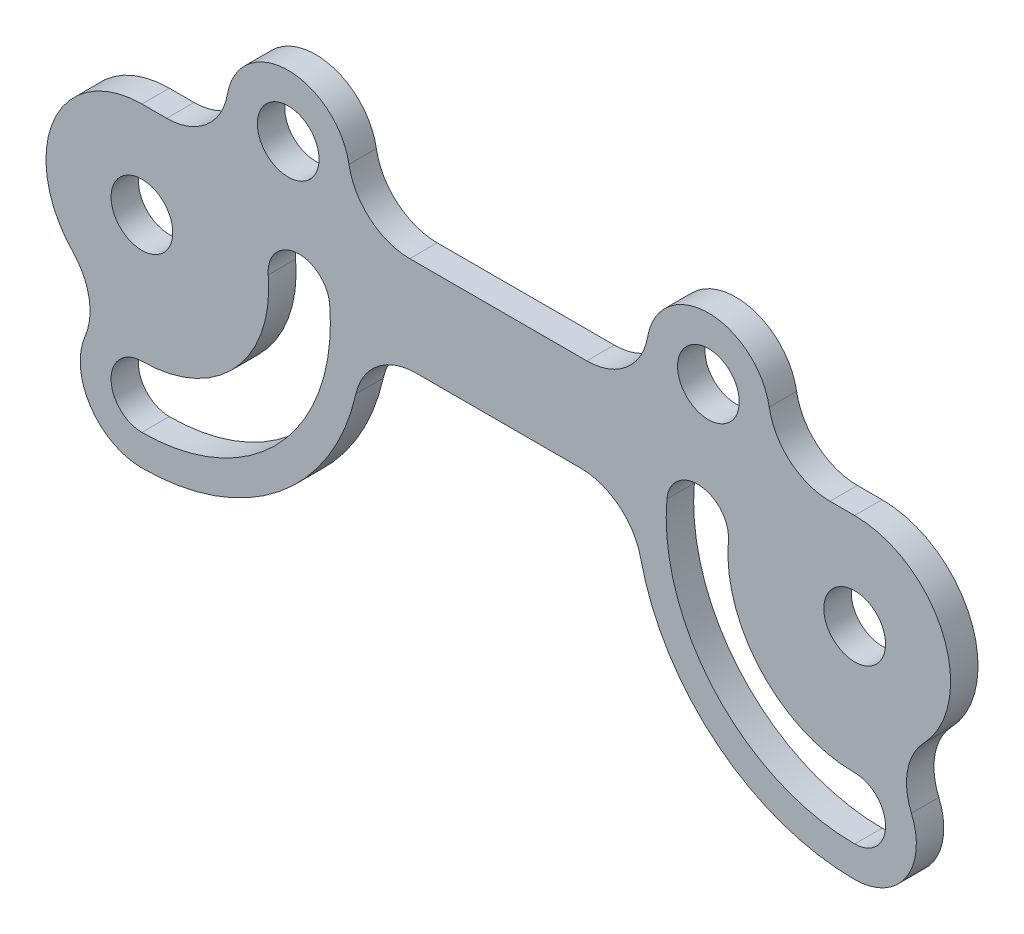
from build123d import *

# Parameters (mm, degrees)
SKETCH1_R           = 1.7859375
BOSS_EXTRUDE1_DEPTH = 1.5875
FILLET1_R           = 3.571875


with BuildPart() as part:
    # Sketch1 → Boss-Extrude1 (new body)
    with BuildSketch(Plane.XY):
        with BuildLine():
            ThreePointArc((41.275, -12.7), (44.846875, -9.128125), (41.275, -5.55625))
            ThreePointArc((41.275, -5.55625), (46.83125, 0), (41.275, 5.55625))
            Line((41.275, 5.55625), (35.489019559, 5.55625))
            ThreePointArc((35.489019559, 5.55625), (32.804229109, 11.484009389), (30.119438658, 5.55625))
            Line((30.119438658, 5.55625), (11.155561342, 5.55625))
            ThreePointArc((11.155561342, 5.55625), (8.470770891, 11.484009389), (5.785980441, 5.55625))
            Line((5.785980441, 5.55625), (0, 5.55625))
            ThreePointArc((0, 5.55625), (-5.55625, 0), (0, -5.55625))
            ThreePointArc((0, -5.55625), (-3.571875, -9.128125), (0, -12.7))
            ThreePointArc((0, -12.7), (8.980256121, -8.980256121), (12.7, 0))
            Line((12.7, 0), (28.575, 0))
            ThreePointArc((28.575, 0), (32.294743879, -8.980256121), (41.275, -12.7))
        make_face()
        with BuildLine():
            ThreePointArc((0, -10.9140625), (-1.7859375, -9.128125), (0, -7.3421875))
            ThreePointArc((0, -7.3421875), (5.413228446, -4.960309977), (7.31424826, 0.639913805))
            ThreePointArc((7.31424826, 0.639913805), (8.937735019, 2.574709983), (10.872531197, 0.951223224))
            ThreePointArc((10.872531197, 0.951223224), (8.046690934, -7.37343375), (0, -10.9140625))
        make_face(mode=Mode.SUBTRACT)
        with BuildLine():
            ThreePointArc((33.96075174, 0.639913805), (35.861771554, -4.960309977), (41.275, -7.3421875))
            ThreePointArc((41.275, -7.3421875), (43.0609375, -9.128125), (41.275, -10.9140625))
            ThreePointArc((41.275, -10.9140625), (33.228309066, -7.37343375), (30.402468803, 0.951223224))
            ThreePointArc((30.402468803, 0.951223224), (32.337264981, 2.574709983), (33.96075174, 0.639913805))
        make_face(mode=Mode.SUBTRACT)
        Circle(SKETCH1_R, mode=Mode.SUBTRACT)
        with Locations((8.470770891, 7.912134389)):
            Circle(SKETCH1_R, mode=Mode.SUBTRACT)
        with Locations((41.275, 0)):
            Circle(SKETCH1_R, mode=Mode.SUBTRACT)
        with Locations((32.804229109, 7.912134389)):
            Circle(SKETCH1_R, mode=Mode.SUBTRACT)
    extrude(amount=BOSS_EXTRUDE1_DEPTH)

    # Fillet1
    fillet1_edges = [part.edges().sort_by_distance(p)[0] for p in [
        (5.785980441, 5.55625, 0.79375),
        (11.155561342, 5.55625, 0.79375),
        (30.119438658, 5.55625, 0.79375),
        (35.489019559, 5.55625, 0.79375),
        (41.275, -5.55625, 0.79375),
        (28.575, 0, 0.79375),
        (12.7, 0, 0.79375),
        (0, -5.55625, 0.79375),
    ]]
    fillet(fillet1_edges, radius=FILLET1_R)


solid = part.part
